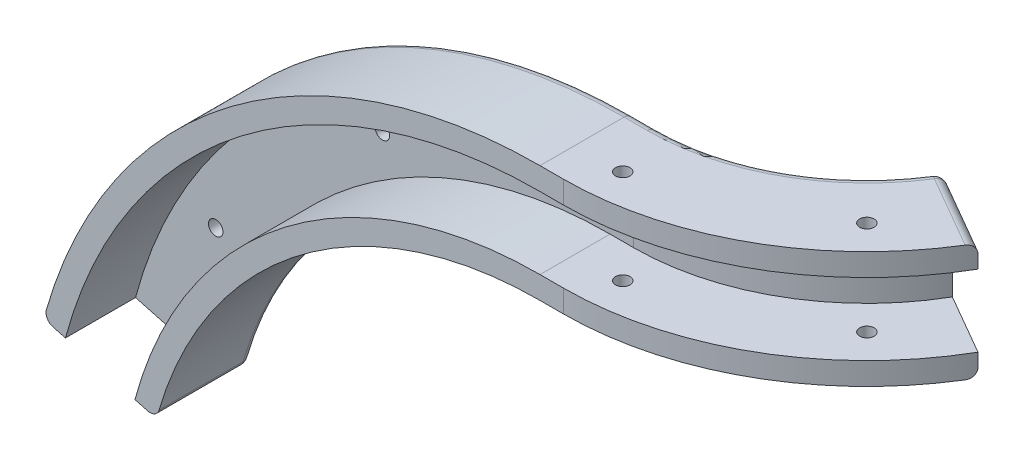
from build123d import *

# Parameters (mm, degrees)
SKETCH_1_R          = 1.55
EXTRUDE_1_DEPTH     = 20
SKETCH_3_R          = 1.55
EXTRUDE_2_DEPTH     = 25
FILLET_1_R          = 2
CUT_EXTRUDE_1_DEPTH = 15
CUT_EXTRUDE_START   = 15.4
CUT_EXTRUDE_2_DEPTH = 15.4


with BuildPart() as part:
    # 草图1 → 凸台-拉伸1 (new body)
    with BuildSketch(Plane.XY):
        with BuildLine():
            Line((-106.251840892, 28.470094961), (-82.103695235, 21.999618834))
            ThreePointArc((-82.103695235, 21.999618834), (-51.744721466, 67.435033925), (0, 85))
            Line((0, 85), (5, 85))
            Line((5, 85), (5, 110))
            Line((5, 110), (0, 110))
            ThreePointArc((0, 110), (-66.963757191, 87.268867432), (-106.251840892, 28.470094961))
        make_face()
        with Locations((-48.75, 84.437476869)):
            Circle(SKETCH_1_R, mode=Mode.SUBTRACT)
        with Locations((-84.437476869, 48.75)):
            Circle(SKETCH_1_R, mode=Mode.SUBTRACT)
    extrude(amount=EXTRUDE_1_DEPTH)

    # 草图3 → 凸台-拉伸2 (add)
    with BuildSketch(Plane.XZ.offset(-85)):
        with BuildLine():
            Line((43.97114317, -22.5), (61.291651246, -12.5))
            ThreePointArc((61.291651246, -12.5), (37.5, 11.291651246), (5, 20))
            Line((5, 20), (5, 0))
            ThreePointArc((5, 0), (27.5, -6.02885683), (43.97114317, -22.5))
        make_face()
        with Locations(Location((10.011455208, 12.28119514, 0), (0, 0, 270))):
            Circle(SKETCH_3_R, mode=Mode.SUBTRACT)
        with Locations(Location((45.658639918, -4.341360082, 0), (0, 0, 270))):
            Circle(SKETCH_3_R, mode=Mode.SUBTRACT)
    extrude(amount=-EXTRUDE_2_DEPTH)

    # 圆角1
    fillet_1_edges = [part.edges().sort_by_distance(p)[0] for p in [
        (-82.103695235, 21.999618834, 10),
        (-106.251840892, 28.470094961, 10),
        (43.97114317, 97.5, -22.5),
        (27.5, 85, -6.02885683),
        (52.631397208, 85, -17.5),
        (52.631397208, 110, -17.5),
        (27.5, 110, -6.02885683),
        (2.5, 110, 0),
        (2.5, 85, 0),
        (-51.744721466, 67.435033925, 0),
        (-94.177768063, 25.234856897, 0),
        (-66.963757191, 87.268867432, 0),
    ]]
    fillet(fillet_1_edges, radius=FILLET_1_R)

    # 草图4 → 切除-拉伸1 (cut)
    with BuildSketch(Plane.XY.offset(20)):
        with BuildLine():
            Line((-101.615396926, 27.227763545), (-86.740139201, 23.24195025))
            ThreePointArc((-86.740139201, 23.24195025), (-54.666776325, 71.243129958), (0, 89.8))
            Line((0, 89.8), (5, 89.8))
            Line((5, 89.8), (5, 105.2))
            Line((5, 105.2), (0, 105.2))
            ThreePointArc((0, 105.2), (-64.041702332, 83.460771399), (-101.615396926, 27.227763545))
        make_face()
    extrude(amount=-CUT_EXTRUDE_1_DEPTH, mode=Mode.SUBTRACT)

    # 草图5 → 切除-拉伸2 (cut)
    with BuildSketch(Plane.XZ.offset(-105.2).offset(CUT_EXTRUDE_START)):
        with BuildLine():
            Line((5, 20), (5, 5))
            ThreePointArc((5, 5), (30, -1.698729811), (48.301270189, -20))
            Line((48.301270189, -20), (61.291651246, -12.5))
            ThreePointArc((61.291651246, -12.5), (37.5, 11.291651246), (5, 20))
        make_face()
    extrude(amount=-CUT_EXTRUDE_2_DEPTH, mode=Mode.SUBTRACT)


solid = part.part
